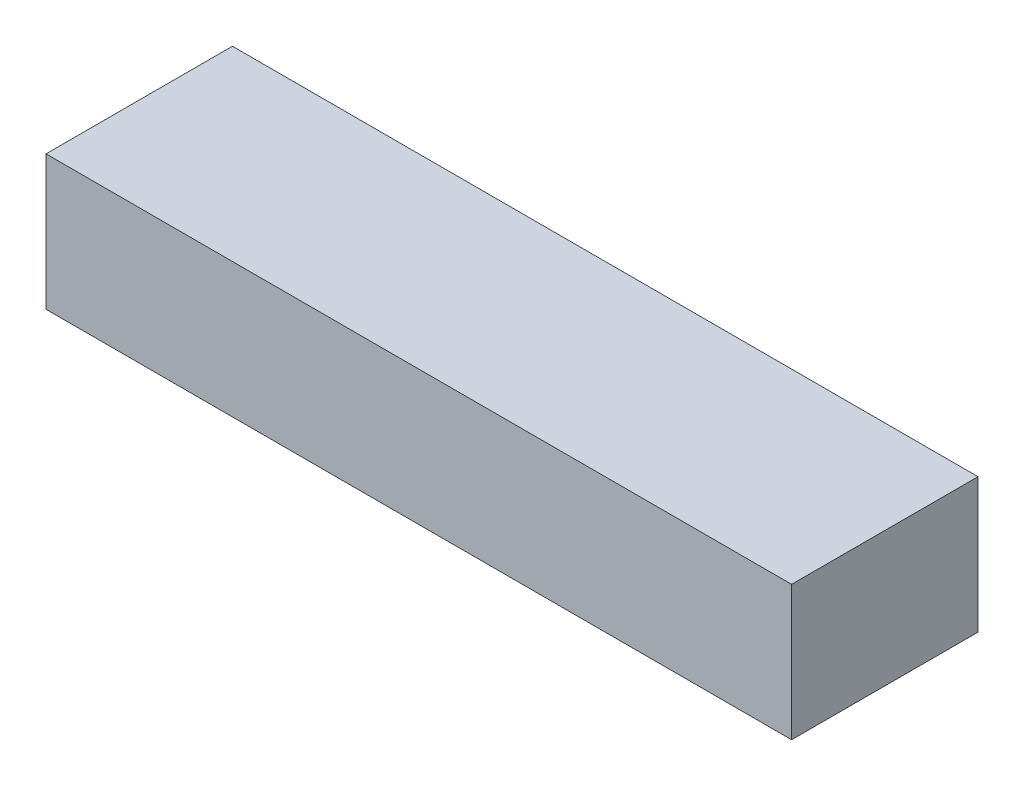
from build123d import *

# Parameters (mm, degrees)
IZIM1_W                     = 108
IZIM1_H                     = 27
Y_KSEKLIK_EKSTR_ZYON1_DEPTH = 19.5


with BuildPart() as part:
    # Çizim1 → Yükseklik-Ekstrüzyon1 (new body)
    with BuildSketch(Plane(origin=(0, 0, 0), x_dir=(1, 0, 0), z_dir=(0, 1, 0))):
        Rectangle(IZIM1_W, IZIM1_H)
    extrude(amount=Y_KSEKLIK_EKSTR_ZYON1_DEPTH)


solid = part.part
